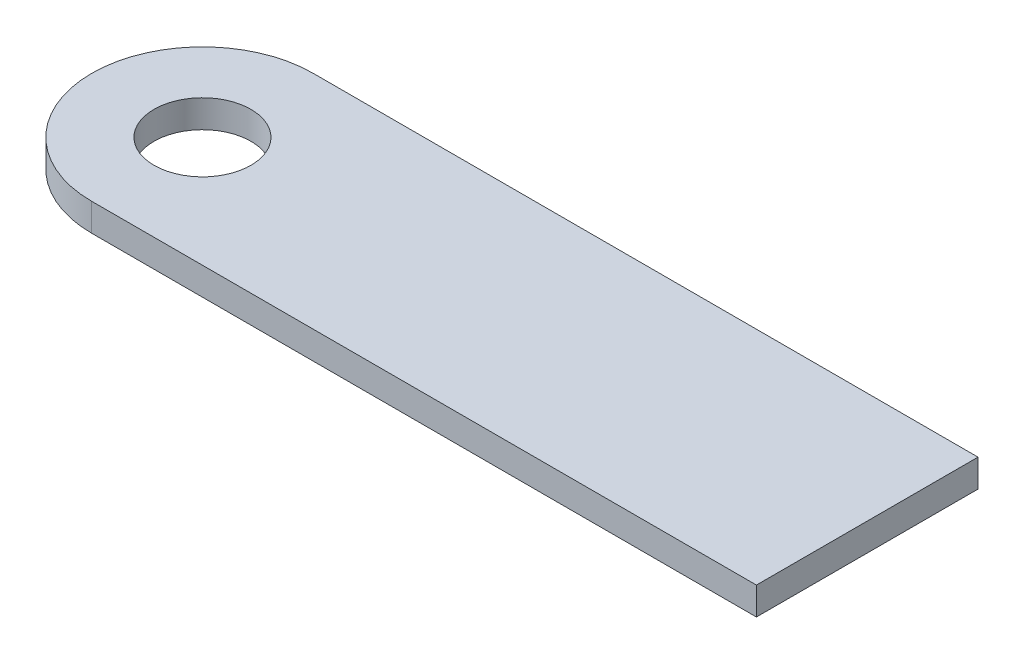
from build123d import *

# Parameters (mm, degrees)
SKETCH1_R           = 5.55625
BOSS_EXTRUDE1_DEPTH = 3.175


with BuildPart() as part:
    # Sketch1 → Boss-Extrude1 (new body)
    with BuildSketch(Plane(origin=(0, 0, 0), x_dir=(1, 0, 0), z_dir=(0, 1, 0))):
        with BuildLine():
            Line((38.1, -12.7), (-38.1, -12.7))
            ThreePointArc((-38.1, -12.7), (-50.8, 0), (-38.1, 12.7))
            Line((-38.1, 12.7), (38.1, 12.7))
            Line((38.1, 12.7), (38.1, -12.7))
        make_face()
        with Locations(Location((-38.1, 0, 0), (0, 0, 270))):
            Circle(SKETCH1_R, mode=Mode.SUBTRACT)
    extrude(amount=BOSS_EXTRUDE1_DEPTH)


solid = part.part
